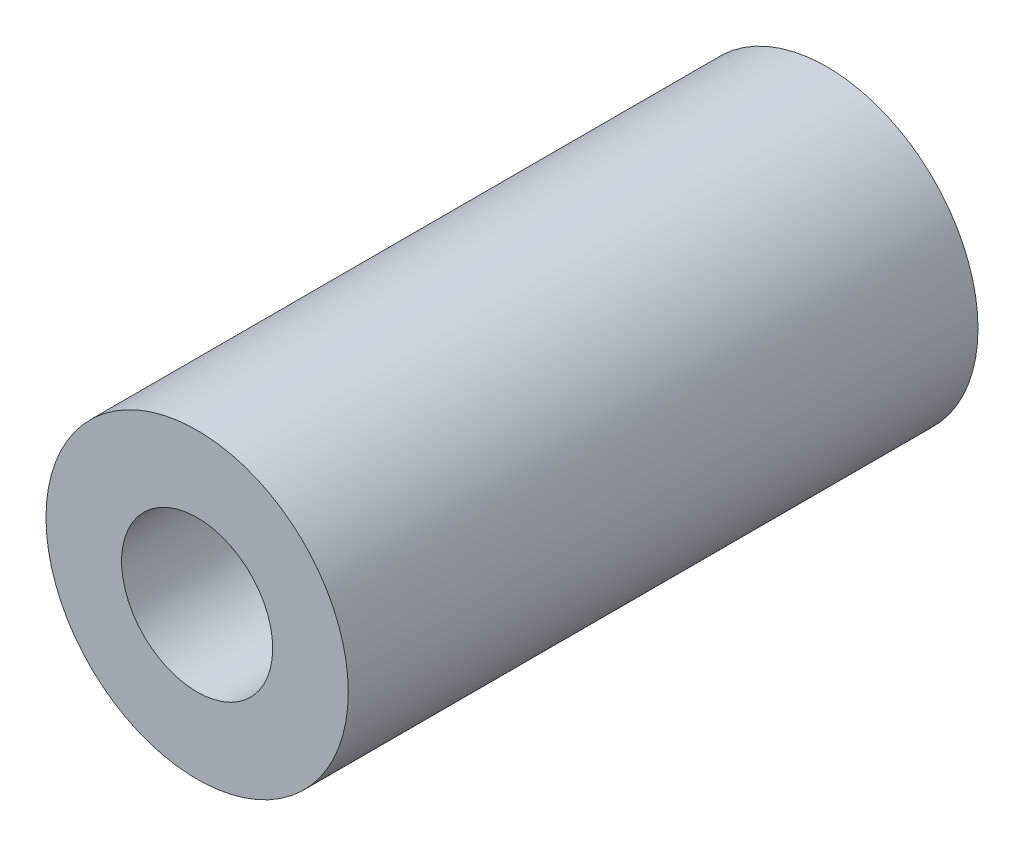
from build123d import *

# Parameters (mm, degrees)
IZIM1_R                     = 6
IZIM1_R_2                   = 3
Y_KSEKLIK_EKSTR_ZYON1_DEPTH = 25


with BuildPart() as part:
    # Çizim1 → Yükseklik-Ekstrüzyon1 (new body)
    with BuildSketch(Plane.XY):
        Circle(IZIM1_R)
        Circle(IZIM1_R_2, mode=Mode.SUBTRACT)
    extrude(amount=Y_KSEKLIK_EKSTR_ZYON1_DEPTH)


solid = part.part
